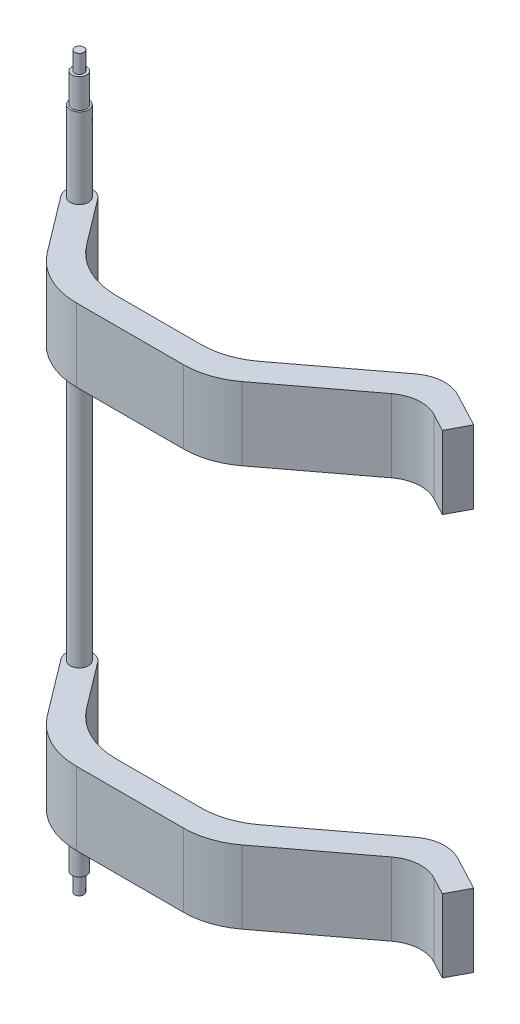
from build123d import *

# Parameters (mm, degrees)
BOSS_EXTRUDE1_START = 4.5
SKETCH2_R           = 0.25
BOSS_EXTRUDE1_DEPTH = 2
BOSS_EXTRUDE2_START = -6.5
SKETCH2_2_R         = 0.25
BOSS_EXTRUDE2_DEPTH = 2
FILLET1_R           = 2
FILLET2_R           = 2
FILLET3_R           = 1
FILLET4_R           = 1


with BuildPart() as part:
    # Sketch1 → Revolve1 (revolve)
    with BuildSketch(Plane.XY):
        Polygon((-1.75, 8.7), (-1.75, -8.7), (-1.7, -8.7), (-1.7, -9.5), (-1.625, -9.5), (-1.625, -10), (-1.5, -10), (-1.5, 10), (-1.625, 10), (-1.625, 9.5), (-1.7, 9.5), (-1.7, 8.7), align=None)
    revolve(axis=Axis((-1.5, 10, 0), (0, -1, 0)))

    # Sketch2 → Boss-Extrude1 (add)
    with BuildSketch(Plane(origin=(0, 0, 0), x_dir=(1, 0, 0), z_dir=(0, 1, 0)).offset(BOSS_EXTRUDE1_START)):
        with BuildLine():
            Line((-1.212744122, 0.216988619), (0.334063036, -1.830719917))
            Line((0.334063036, -1.830719917), (4.334063036, -1.830719917))
            Line((4.334063036, -1.830719917), (7.809461076, 0.794541672))
            Line((7.809461076, 0.794541672), (9.31, 0))
            Line((9.31, 0), (9.012661236, -0.561541836))
            Line((9.012661236, -0.561541836), (7.952156278, 0))
            Line((7.952156278, 0), (4.575438683, -2.550719917))
            Line((4.575438683, -2.550719917), (-0.024391576, -2.550719917))
            Line((-0.024391576, -2.550719917), (-1.787255878, -0.216988619))
            ThreePointArc((-1.787255878, -0.216988619), (-1.716988619, 0.287255878), (-1.212744122, 0.216988619))
        make_face()
        with Locations((-1.5, 0)):
            Circle(SKETCH2_R, mode=Mode.SUBTRACT)
    extrude(amount=BOSS_EXTRUDE1_DEPTH)

    # Sketch2<2> → Boss-Extrude2 (add)
    with BuildSketch(Plane(origin=(0, 0, 0), x_dir=(1, 0, 0), z_dir=(0, 1, 0)).offset(BOSS_EXTRUDE2_START)):
        with BuildLine():
            Line((-1.212744122, 0.216988619), (0.334063036, -1.830719917))
            Line((0.334063036, -1.830719917), (4.334063036, -1.830719917))
            Line((4.334063036, -1.830719917), (7.809461076, 0.794541672))
            Line((7.809461076, 0.794541672), (9.31, 0))
            Line((9.31, 0), (9.012661236, -0.561541836))
            Line((9.012661236, -0.561541836), (7.952156278, 0))
            Line((7.952156278, 0), (4.575438683, -2.550719917))
            Line((4.575438683, -2.550719917), (-0.024391576, -2.550719917))
            Line((-0.024391576, -2.550719917), (-1.787255878, -0.216988619))
            ThreePointArc((-1.787255878, -0.216988619), (-1.716988619, 0.287255878), (-1.212744122, 0.216988619))
        make_face()
        with Locations((-1.5, 0)):
            Circle(SKETCH2_2_R, mode=Mode.SUBTRACT)
    extrude(amount=BOSS_EXTRUDE2_DEPTH)

    # Fillet1
    fillet1_edges = [part.edges().sort_by_distance(p)[0] for p in [
        (4.334063036, 5.5, 1.830719917),
        (4.334063036, -5.5, 1.830719917),
        (0.334063036, 5.5, 1.830719917),
        (0.334063036, -5.5, 1.830719917),
    ]]
    fillet(fillet1_edges, radius=FILLET1_R)

    # Fillet2
    fillet2_edges = [part.edges().sort_by_distance(p)[0] for p in [
        (4.575438683, -5.5, 2.550719917),
        (-0.024391576, -5.5, 2.550719917),
        (4.575438683, 5.5, 2.550719917),
        (-0.024391576, 5.5, 2.550719917),
    ]]
    fillet(fillet2_edges, radius=FILLET2_R)

    # Fillet3
    fillet3_edges = [part.edges().sort_by_distance(p)[0] for p in [
        (7.809461076, 5.5, -0.794541672),
        (7.809461076, -5.5, -0.794541672),
    ]]
    fillet(fillet3_edges, radius=FILLET3_R)

    # Fillet4
    fillet4_edges = [part.edges().sort_by_distance(p)[0] for p in [
        (7.952156278, -5.5, 0),
        (7.952156278, 5.5, 0),
    ]]
    fillet(fillet4_edges, radius=FILLET4_R)


solid = part.part
